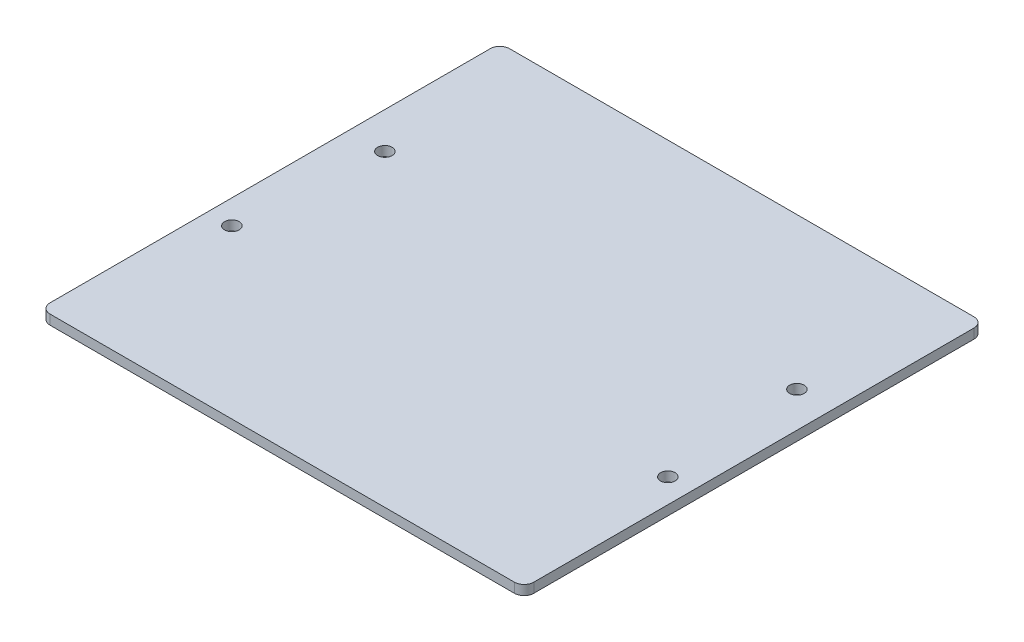
from build123d import *

# Parameters (mm, degrees)
SKETCH_1_W      = 100
SKETCH_1_H      = 95
EXTRUDE_1_DEPTH = 2
HOLE_WIZARD_1_D = 3
FILLET_1_R      = 2


with BuildPart() as part:
    # 草图1 → 凸台-拉伸1 (new body)
    with BuildSketch(Plane(origin=(0, 0, 0), x_dir=(1, 0, 0), z_dir=(0, 1, 0))):
        Rectangle(SKETCH_1_W, SKETCH_1_H)
    extrude(amount=EXTRUDE_1_DEPTH)

    # 孔1 (through all)
    with Locations(Plane(origin=(0, 2, 0), x_dir=(1, 0, 0), z_dir=(0, 1, 0))):
        with Locations((-45, -12.906), (-42.5, 16.216), (42.673, 16.216), (45, -12.784)):
            Hole(HOLE_WIZARD_1_D / 2)

    # 圆角1
    fillet_1_edges = [part.edges().sort_by_distance(p)[0] for p in [
        (50, 1, 47.5),
        (-50, 1, 47.5),
        (-50, 1, -47.5),
        (50, 1, -47.5),
    ]]
    fillet(fillet_1_edges, radius=FILLET_1_R)


solid = part.part
